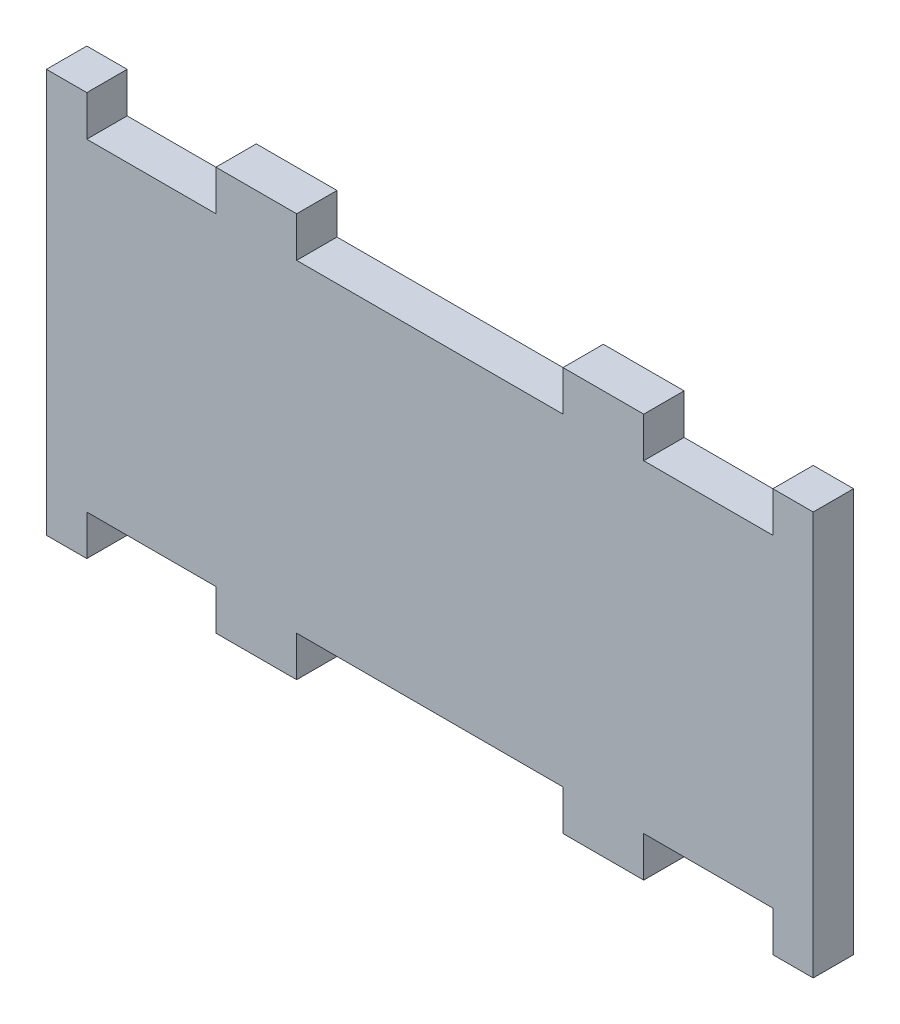
from build123d import *

# Parameters (mm, degrees)
SKETCH1_W           = 120.65
SKETCH1_H           = 63.5
BOSS_EXTRUDE1_DEPTH = 6.35
CUT_EXTRUDE1_REACH  = 138.488
SKETCH2_W           = 20.32
SKETCH2_H           = 6.35
SKETCH2_W_2         = 41.91


with BuildPart() as part:
    # Sketch1 → Boss-Extrude1 (new body)
    with BuildSketch(Plane.XY):
        with Locations((60.325, 31.75)):
            Rectangle(SKETCH1_W, SKETCH1_H)
    extrude(amount=BOSS_EXTRUDE1_DEPTH)

    # Sketch2 → Cut-Extrude1 (cut, up to next)
    with BuildSketch(Plane.XY.offset(6.35), mode=Mode.PRIVATE) as cut_extrude1_sk1:
        with Locations((16.51, 60.325)):
            Rectangle(SKETCH2_W, SKETCH2_H)
    cut_extrude1_tool1 = extrude(cut_extrude1_sk1.sketch, amount=-CUT_EXTRUDE1_REACH, mode=Mode.PRIVATE) & part.part
    # Sketch2 → Cut-Extrude1 (cut, up to next)
    with BuildSketch(Plane.XY.offset(6.35), mode=Mode.PRIVATE) as cut_extrude1_sk2:
        with Locations((60.325, 60.325)):
            Rectangle(SKETCH2_W_2, SKETCH2_H)
    cut_extrude1_tool2 = extrude(cut_extrude1_sk2.sketch, amount=-CUT_EXTRUDE1_REACH, mode=Mode.PRIVATE) & part.part
    # Sketch2 → Cut-Extrude1 (cut, up to next)
    with BuildSketch(Plane.XY.offset(6.35), mode=Mode.PRIVATE) as cut_extrude1_sk3:
        with Locations((104.14, 60.325)):
            Rectangle(SKETCH2_W, SKETCH2_H)
    cut_extrude1_tool3 = extrude(cut_extrude1_sk3.sketch, amount=-CUT_EXTRUDE1_REACH, mode=Mode.PRIVATE) & part.part
    # Sketch2 → Cut-Extrude1 (cut, up to next)
    with BuildSketch(Plane.XY.offset(6.35), mode=Mode.PRIVATE) as cut_extrude1_sk4:
        with Locations((104.14, 3.175)):
            Rectangle(SKETCH2_W, SKETCH2_H)
    cut_extrude1_tool4 = extrude(cut_extrude1_sk4.sketch, amount=-CUT_EXTRUDE1_REACH, mode=Mode.PRIVATE) & part.part
    # Sketch2 → Cut-Extrude1 (cut, up to next)
    with BuildSketch(Plane.XY.offset(6.35), mode=Mode.PRIVATE) as cut_extrude1_sk5:
        with Locations((60.325, 3.175)):
            Rectangle(SKETCH2_W_2, SKETCH2_H)
    cut_extrude1_tool5 = extrude(cut_extrude1_sk5.sketch, amount=-CUT_EXTRUDE1_REACH, mode=Mode.PRIVATE) & part.part
    # Sketch2 → Cut-Extrude1 (cut, up to next)
    with BuildSketch(Plane.XY.offset(6.35), mode=Mode.PRIVATE) as cut_extrude1_sk6:
        with Locations((16.51, 3.175)):
            Rectangle(SKETCH2_W, SKETCH2_H)
    cut_extrude1_tool6 = extrude(cut_extrude1_sk6.sketch, amount=-CUT_EXTRUDE1_REACH, mode=Mode.PRIVATE) & part.part
    add(cut_extrude1_tool1.solids().sort_by_distance((16.51, 60.325, 6.35))[0], mode=Mode.SUBTRACT)
    add(cut_extrude1_tool2.solids().sort_by_distance((60.325, 60.325, 6.35))[0], mode=Mode.SUBTRACT)
    add(cut_extrude1_tool3.solids().sort_by_distance((104.14, 60.325, 6.35))[0], mode=Mode.SUBTRACT)
    add(cut_extrude1_tool4.solids().sort_by_distance((104.14, 3.175, 6.35))[0], mode=Mode.SUBTRACT)
    add(cut_extrude1_tool5.solids().sort_by_distance((60.325, 3.175, 6.35))[0], mode=Mode.SUBTRACT)
    add(cut_extrude1_tool6.solids().sort_by_distance((16.51, 3.175, 6.35))[0], mode=Mode.SUBTRACT)


solid = part.part
